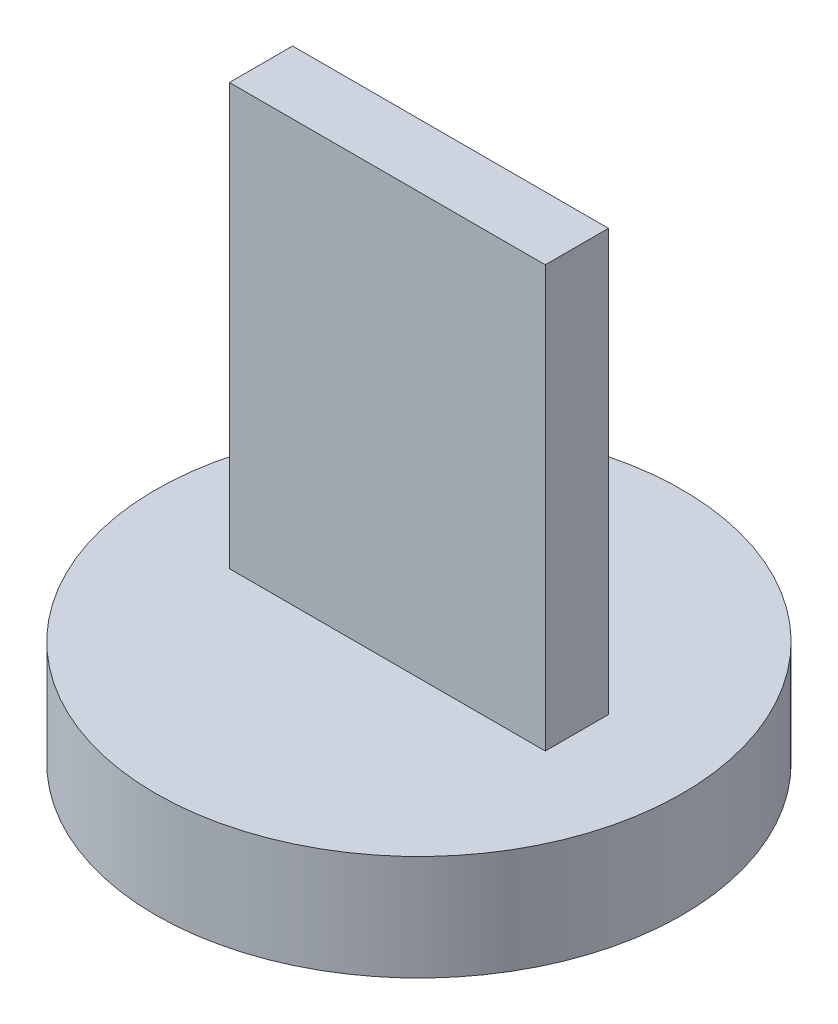
from build123d import *

# Parameters (mm, degrees)
SKIZZE1_R                       = 2.5
AUFSATZ_LINEAR_AUSTRAGEN1_DEPTH = 1
SKIZZE2_W                       = 3
SKIZZE2_H                       = 0.6
AUFSATZ_LINEAR_AUSTRAGEN2_DEPTH = 4


with BuildPart() as part:
    # Skizze1 → Aufsatz-Linear austragen1 (new body)
    with BuildSketch(Plane(origin=(0, 0, 0), x_dir=(1, 0, 0), z_dir=(0, 1, 0))):
        with Locations(Location((0, 0, 0), (0, 0, 270))):
            Circle(SKIZZE1_R)
    extrude(amount=AUFSATZ_LINEAR_AUSTRAGEN1_DEPTH)

    # Skizze2 → Aufsatz-Linear austragen2 (add)
    with BuildSketch(Plane(origin=(0, 1, 0), x_dir=(1, 0, 0), z_dir=(0, 1, 0))):
        Rectangle(SKIZZE2_W, SKIZZE2_H)
    extrude(amount=AUFSATZ_LINEAR_AUSTRAGEN2_DEPTH)


solid = part.part
